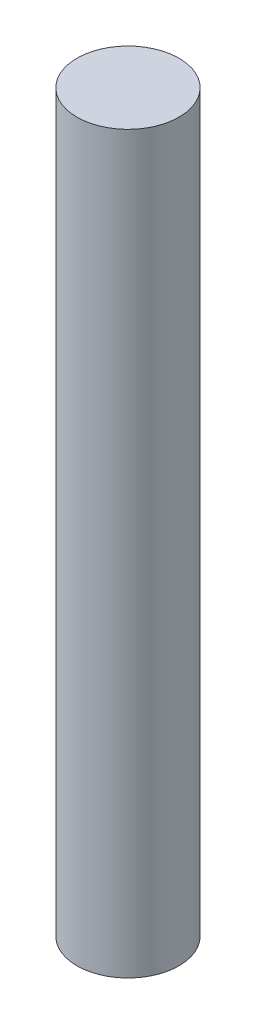
from build123d import *

# Parameters (mm, degrees)
SKETCH1_R           = 3.96875
BOSS_EXTRUDE1_DEPTH = 57.15


with BuildPart() as part:
    # Sketch1 → Boss-Extrude1 (new body)
    with BuildSketch(Plane(origin=(0, 0, 0), x_dir=(1, 0, 0), z_dir=(0, 1, 0))):
        with Locations(Location((0, 0, 0), (0, 0, 270))):
            Circle(SKETCH1_R)
    extrude(amount=BOSS_EXTRUDE1_DEPTH)


solid = part.part
